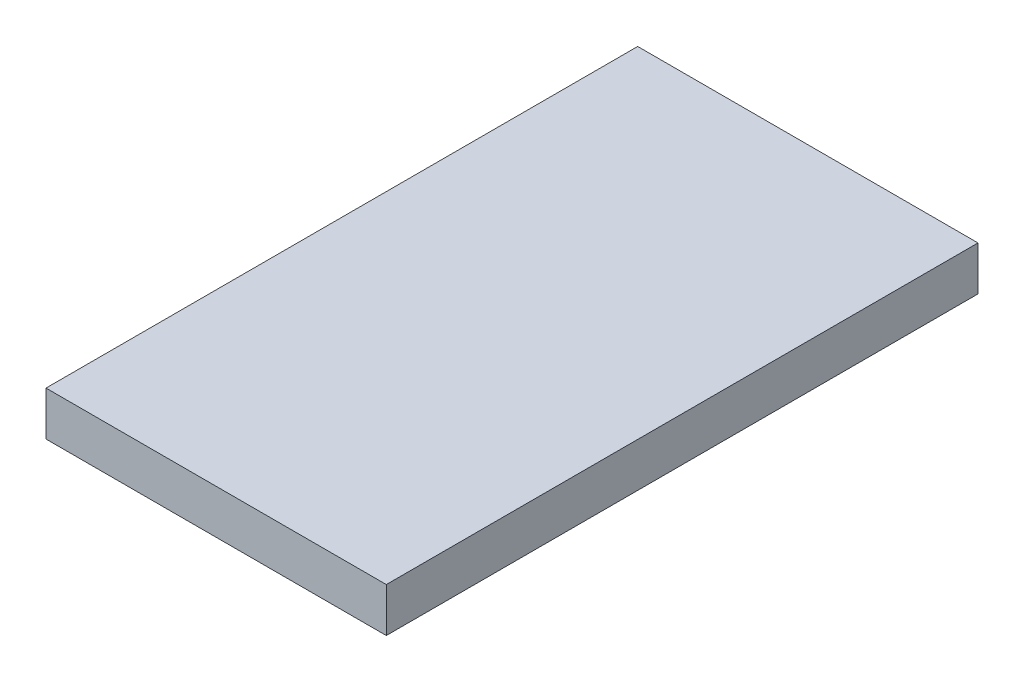
from build123d import *

# Parameters (mm, degrees)
SKETCH3_W      = 58.435046082
SKETCH3_H      = 7.585257796
EXTRUDE2_DEPTH = 101.6


with BuildPart() as part:
    # Sketch3 → Extrude2 (new body)
    with BuildSketch(Plane.XY):
        with Locations((29.217523041, 3.792628898)):
            Rectangle(SKETCH3_W, SKETCH3_H)
    extrude(amount=EXTRUDE2_DEPTH)


solid = part.part
